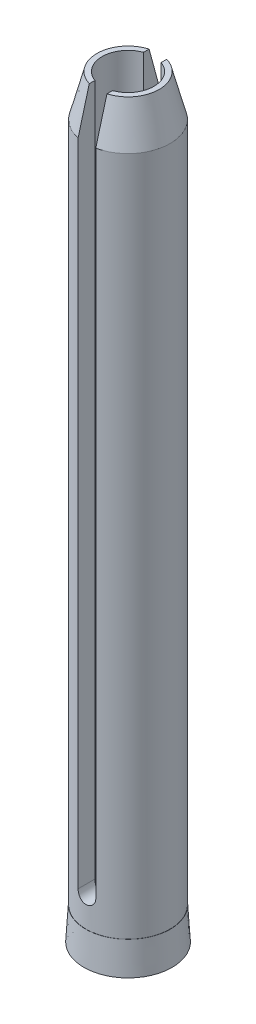
from build123d import *

# Parameters (mm, degrees)
CROQUIS1_R                 = 8.24
SALIENTE_EXTRUIR1_DEPTH    = 6
CROQUIS3_R                 = 7.85
SALIENTE_EXTRUIR2_DEPTH    = 134.8
CROQUIS4_R                 = 4.835
CORTAR_EXTRUIR1_DEPTH      = 142.281404297
CORTAR_EXTRUIR2_DEPTH      = 142.281404297
CORTAR_EXTRUIR2_DEPTH_BACK = 142.281404297


with BuildPart() as part:
    # Croquis1 → Saliente-Extruir1 (new body)
    with BuildSketch(Plane(origin=(0, 0, 0), x_dir=(1, 0, 0), z_dir=(0, 1, 0))):
        with Locations(Location((0, 0, 0), (0, 0, 270))):
            Circle(CROQUIS1_R)
    extrude(amount=SALIENTE_EXTRUIR1_DEPTH)

    # Croquis2 → Cortar-Revolución1 (revolve, cut)
    with BuildSketch(Plane.XY, mode=Mode.PRIVATE) as cortar_revoluci_n1_sk:
        Polygon((-8.24, 0), (-7.883666073, 6), (-8.24, 6), align=None)
    revolve(cortar_revoluci_n1_sk.sketch.rotate(Axis((0, 0, 0), (0, 1, 0)), 270), axis=Axis((0, 0, 0), (0, 1, 0)), mode=Mode.SUBTRACT)

    # Croquis3 → Saliente-Extruir2 (add)
    with BuildSketch(Plane(origin=(0, 6, 0), x_dir=(1, 0, 0), z_dir=(0, 1, 0))):
        with Locations(Location((0, 0, 0), (0, 0, 270))):
            Circle(CROQUIS3_R)
    extrude(amount=SALIENTE_EXTRUIR2_DEPTH)

    # Croquis4 → Cortar-Extruir1 (cut, through all)
    with BuildSketch(Plane(origin=(0, 140.8, 0), x_dir=(1, 0, 0), z_dir=(0, 1, 0))):
        with Locations(Location((0, 0, 0), (0, 0, 270))):
            Circle(CROQUIS4_R)
    extrude(amount=-CORTAR_EXTRUIR1_DEPTH, mode=Mode.SUBTRACT)

    # Croquis5 → Cortar-Extruir2 (cut, two sides: drawn at the far end of the back side and taken through both)
    with BuildSketch(Plane.XY.offset(-CORTAR_EXTRUIR2_DEPTH_BACK)):
        with BuildLine():
            Line((1.65, 140.8), (-1.65, 140.8))
            Line((-1.65, 140.8), (-1.65, 11.621418712))
            ThreePointArc((-1.65, 11.621418712), (0, 9.97), (1.65, 11.621418712))
            Line((1.65, 11.621418712), (1.65, 140.8))
        make_face()
    extrude(amount=CORTAR_EXTRUIR2_DEPTH + CORTAR_EXTRUIR2_DEPTH_BACK, mode=Mode.SUBTRACT)

    # Croquis7 → Cortar-Revolución2 (revolve, cut)
    with BuildSketch(Plane.XY, mode=Mode.PRIVATE) as cortar_revoluci_n2_sk:
        Polygon((11.646495886, 140.8), (7.85, 133.06), (5.823247943, 140.8), align=None)
    revolve(cortar_revoluci_n2_sk.sketch.rotate(Axis((0, 140.8, 0), (0, -1, 0)), 257.866449584), axis=Axis((0, 140.8, 0), (0, -1, 0)), mode=Mode.SUBTRACT)


solid = part.part
